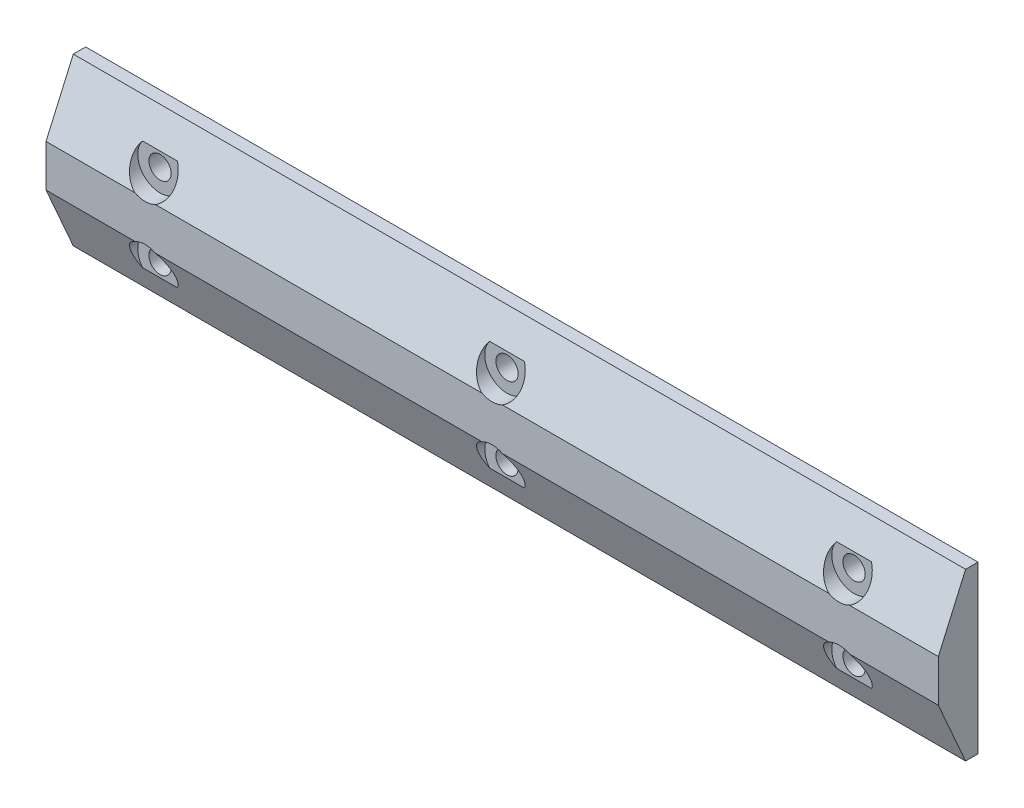
from build123d import *

# Parameters (mm, degrees)
ESBO_O1_W                                           = 360
ESBO_O1_H                                           = 67
RESSALTO_EXTRUS_O1_DEPTH                            = 16
CORTE_EXTRUS_O1_DEPTH                               = 367.531035521
REBAIXO_PARA_PARAFUSO_COM_CABE_A_PANELA_D           = 9
REBAIXO_PARA_PARAFUSO_COM_CABE_A_PANELA_CBORE_D     = 18
REBAIXO_PARA_PARAFUSO_COM_CABE_A_PANELA_CBORE_DEPTH = 6


with BuildPart() as part:
    # Esboço1 → Ressalto-extrusão1 (new body)
    with BuildSketch(Plane.XY):
        with Locations((180, 33.5)):
            Rectangle(ESBO_O1_W, ESBO_O1_H)
    extrude(amount=RESSALTO_EXTRUS_O1_DEPTH)

    # Esboço2 → Corte-extrusão1 (cut, through all)
    with BuildSketch(Plane.ZY):
        Polygon((5, 0), (16, 25), (16, 0), align=None)
        Polygon((5, 67), (16, 42), (16, 67), align=None)
    extrude(amount=-CORTE_EXTRUS_O1_DEPTH, mode=Mode.SUBTRACT)

    # Rebaixo para parafuso com cabeça panela de M81 (through all)
    with Locations(Plane.XY.offset(16)):
        with Locations((40, 50), (40, 17), (180, 50), (180, 17), (320, 50), (320, 17)):
            CounterBoreHole(REBAIXO_PARA_PARAFUSO_COM_CABE_A_PANELA_D / 2, REBAIXO_PARA_PARAFUSO_COM_CABE_A_PANELA_CBORE_D / 2, REBAIXO_PARA_PARAFUSO_COM_CABE_A_PANELA_CBORE_DEPTH)


solid = part.part
